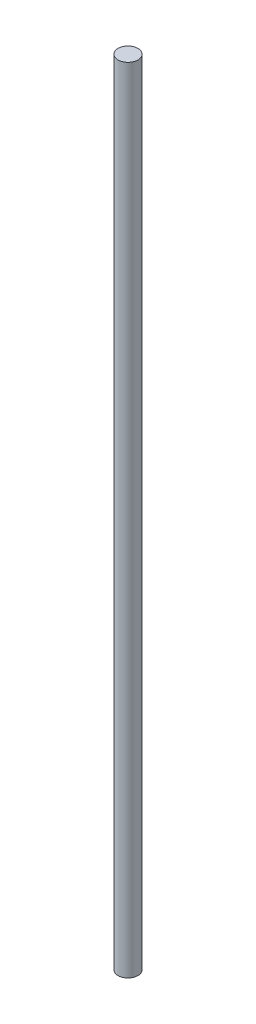
from build123d import *

# Parameters (mm, degrees)
SKETCH1_R           = 1.4
BOSS_EXTRUDE1_DEPTH = 111


with BuildPart() as part:
    # Sketch1 → Boss-Extrude1 (new body)
    with BuildSketch(Plane(origin=(0, 0, 0), x_dir=(1, 0, 0), z_dir=(0, 1, 0))):
        with Locations(Location((0, 0, 0), (0, 0, 270))):
            Circle(SKETCH1_R)
    extrude(amount=BOSS_EXTRUDE1_DEPTH)


solid = part.part
